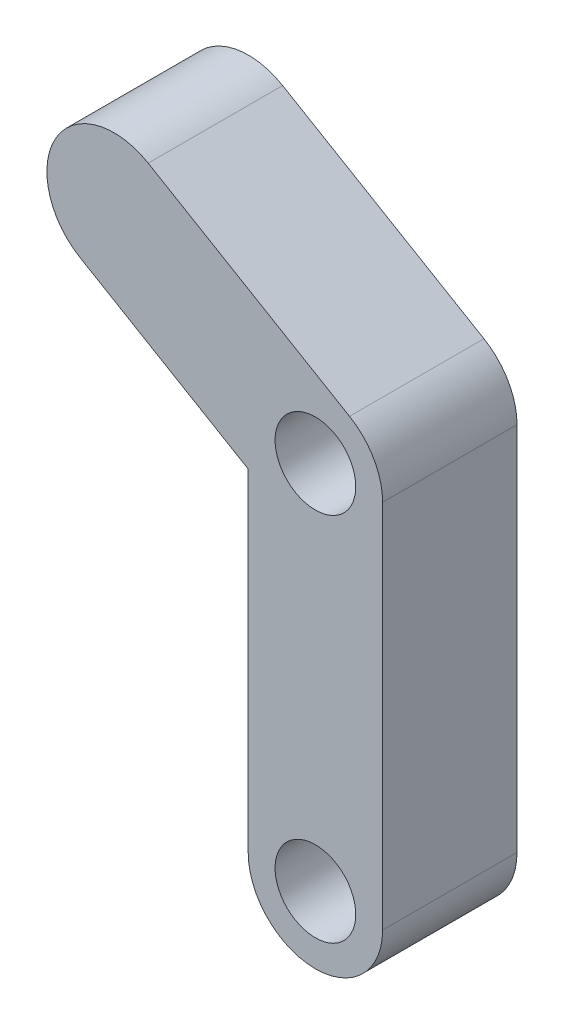
from build123d import *

# Parameters (mm, degrees)
SKIZZE1_R                       = 1.5
AUFSATZ_LINEAR_AUSTRAGEN1_DEPTH = 5


with BuildPart() as part:
    # Skizze1 → Aufsatz-Linear austragen1 (new body)
    with BuildSketch(Plane.XY):
        with BuildLine():
            ThreePointArc((-2.5, 0), (0, -2.5), (2.5, 0))
            Line((2.5, 0), (2.5, 13.78))
            ThreePointArc((2.5, 13.78), (2.170497036, 15.020541259), (1.268845907, 15.934072901))
            Line((1.268845907, 15.934072901), (-6.219211481, 20.344875789))
            ThreePointArc((-6.219211481, 20.344875789), (-9.64213029, 19.459648795), (-8.756903296, 16.036729986))
            Line((-8.756903296, 16.036729986), (-2.5, 12.351132282))
            Line((-2.5, 12.351132282), (-2.5, 0))
        make_face()
        Circle(SKIZZE1_R, mode=Mode.SUBTRACT)
        with Locations((0, 13.78)):
            Circle(SKIZZE1_R, mode=Mode.SUBTRACT)
    extrude(amount=AUFSATZ_LINEAR_AUSTRAGEN1_DEPTH)


solid = part.part
